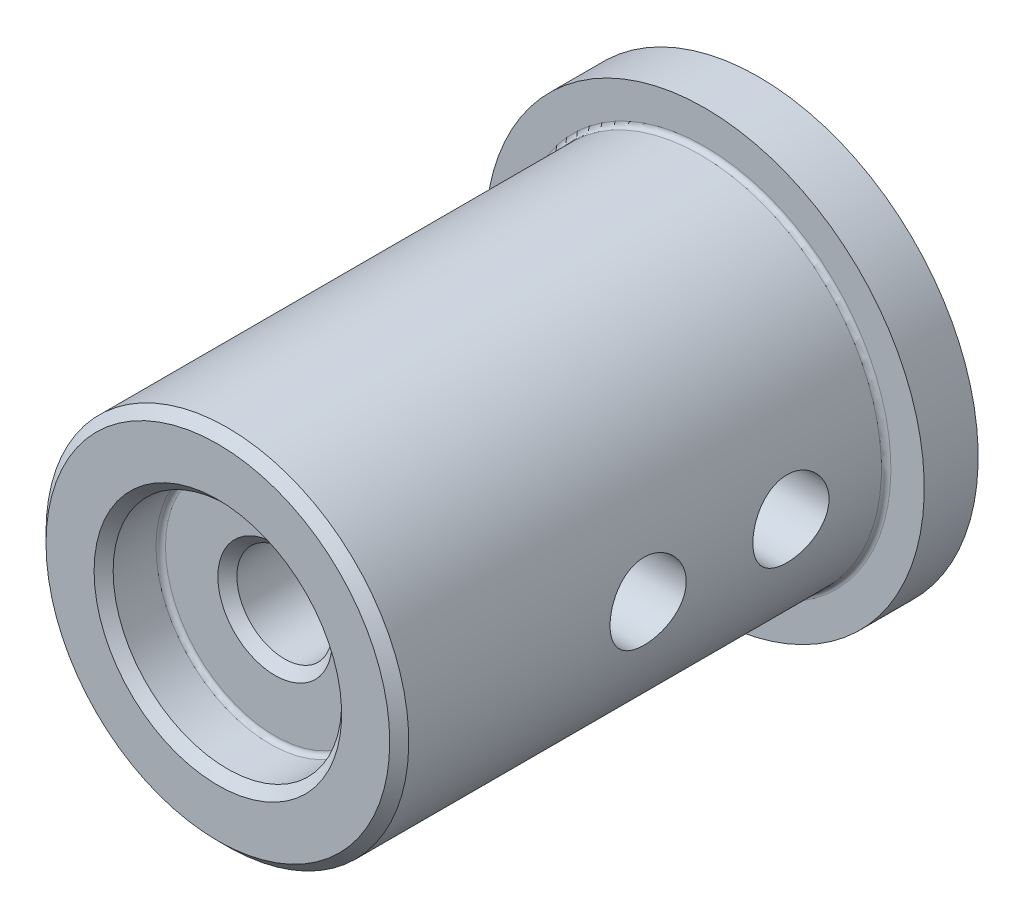
from build123d import *

# Parameters (mm, degrees)
SKETCH3_W          = 2.83
SKETCH3_H          = 2
CHAMFER1_SIZE      = 0.5
FILLET1_R          = 0.25
SKETCH4_R          = 2
CUT_EXTRUDE2_DEPTH = 22.616920456
SKETCH5_R          = 2
CUT_EXTRUDE3_DEPTH = 22.616920456


with BuildPart() as part:
    # Sketch1 → Revolve1 (revolve)
    with BuildSketch(Plane(origin=(0, 0, 0), x_dir=(0, 0, -1), z_dir=(1, 0, 0)), mode=Mode.PRIVATE) as revolve1_sk:
        Polygon((-14.2, 6), (-14.2, 9.525), (14.2, 9.525), (14.2, 6), (-6.8, 6), (-6.8, 2.5), (-11.2, 2.5), (-11.2, 6), align=None)
    revolve(revolve1_sk.sketch.rotate(Axis((0, 0, 14.2), (0, 0, -1)), 90), axis=Axis((0, 0, 14.2), (0, 0, -1)))

    # Sketch3 → Revolve2 (revolve)
    with BuildSketch(Plane(origin=(0, 0, 0), x_dir=(0, 0, -1), z_dir=(1, 0, 0)), mode=Mode.PRIVATE) as revolve2_sk:
        with Locations((12.785, 10.525)):
            Rectangle(SKETCH3_W, SKETCH3_H)
    revolve(revolve2_sk.sketch.rotate(Axis((0, 0, 0), (0, 0, -1)), 90), axis=Axis((0, 0, 0), (0, 0, -1)))

    # Chamfer1
    chamfer1_edges = [part.edges().sort_by_distance(p)[0] for p in [
        (-2.5, 0, 11.2),
        (-6, 0, -14.2),
        (-9.525, 0, 14.2),
        (-6, 0, 14.2),
    ]]
    chamfer(chamfer1_edges, length=CHAMFER1_SIZE)

    # Fillet1
    fillet1_edges = [part.edges().sort_by_distance(p)[0] for p in [
        (-9.525, 0, -11.37),
        (-6, 0, 11.2),
    ]]
    fillet(fillet1_edges, radius=FILLET1_R)

    # Sketch4 → Cut-Extrude2 (cut, through all)
    with BuildSketch(Plane(origin=(0, 0, 0), x_dir=(0, 0, -1), z_dir=(1, 0, 0))):
        with Locations((6.37, 0)):
            Circle(SKETCH4_R)
        with Locations((-1.13, 0)):
            Circle(SKETCH4_R)
    extrude(amount=CUT_EXTRUDE2_DEPTH, mode=Mode.SUBTRACT)

    # Sketch5 → Cut-Extrude3 (cut, through all)
    with BuildSketch(Plane(origin=(0, 0, 0), x_dir=(1, 0, 0), z_dir=(0, 1, 0))):
        with Locations(Location((0, 0, 0), (0, 0, 270))):
            Circle(SKETCH5_R)
    extrude(amount=-CUT_EXTRUDE3_DEPTH, mode=Mode.SUBTRACT)


solid = part.part
